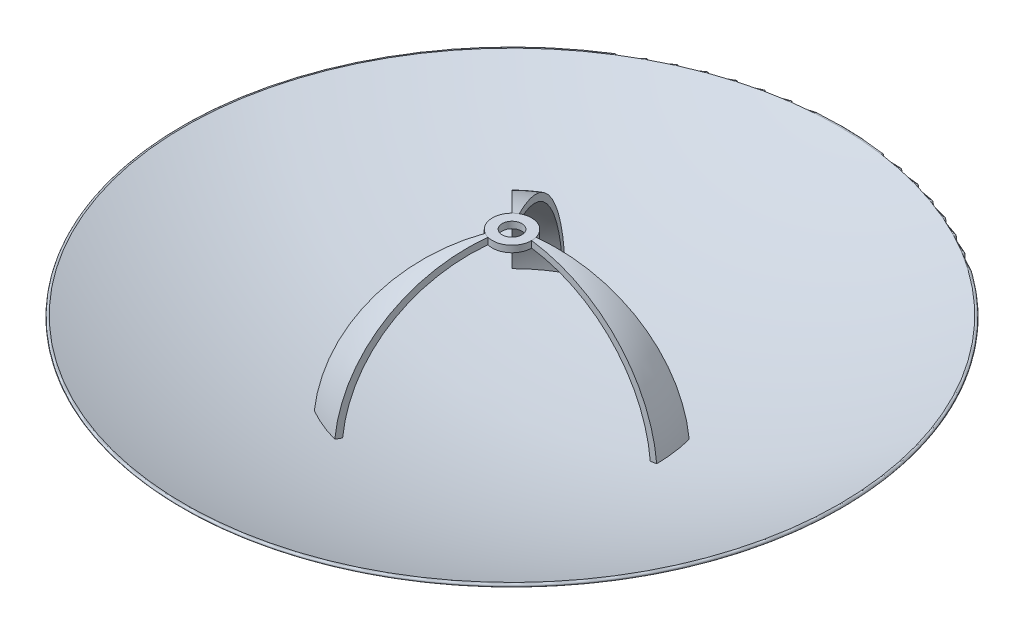
from build123d import *

# Parameters (mm, degrees)
BOSS_EXTRUDE1_DEPTH      = 0.0001
BOSS_EXTRUDE1_DEPTH_BACK = 50
SKETCH2_R                = 20
SKETCH2_R_2              = 15
CUT_EXTRUDE1_DEPTH       = 720.971206266
CUT_EXTRUDE1_DEPTH_BACK  = 720.971206266
SKETCH3_R                = 3
SKETCH8_R                = 30
BOSS_EXTRUDE6_DEPTH      = 10
REVOLVE6_ANGLE           = 15
CIRPATTERN2_COUNT        = 3
SKETCH10_R               = 15
CUT_EXTRUDE2_DEPTH       = 10


with BuildPart() as part:
    # Sketch1 → Revolve1 (revolve)
    with BuildSketch(Plane.XY):
        with BuildLine():
            Line((0, -5), (0, 0))
            ThreePointArc((0, 0), (255.566758163, 26.817376298), (500, 106.101232375))
            ThreePointArc((500, 106.101232375), (503.299845465, 104.831973771), (502.030587523, 101.532128052))
            ThreePointArc((502.030587523, 101.532128052), (256.604659504, 21.926286358), (0, -5))
        make_face()
    revolve(axis=Axis((0, 0, 0), (0, 1, 0)))

    # Sketch2 → Boss-Extrude1 (add, two sides: drawn at the far end of the back side and taken through both)
    with BuildSketch(Plane(origin=(0, 0, 0), x_dir=(1, 0, 0), z_dir=(0, 1, 0)).offset(-BOSS_EXTRUDE1_DEPTH_BACK)):
        Circle(SKETCH2_R)
        Circle(SKETCH2_R_2, mode=Mode.SUBTRACT)
    extrude(amount=BOSS_EXTRUDE1_DEPTH + BOSS_EXTRUDE1_DEPTH_BACK)

    # Sketch3 → Cut-Extrude1 (cut, two sides: drawn at the far end of the back side and taken through both)
    with BuildSketch(Plane(origin=(0, 0, 0), x_dir=(0, 0, -1), z_dir=(1, 0, 0)).offset(-CUT_EXTRUDE1_DEPTH_BACK)):
        with Locations((0, -35)):
            Circle(SKETCH3_R)
    extrude(amount=CUT_EXTRUDE1_DEPTH + CUT_EXTRUDE1_DEPTH_BACK, mode=Mode.SUBTRACT)


with BuildPart() as body_2:
    # Sketch8 → Boss-Extrude6 (new body)
    with BuildSketch(Plane(origin=(0, 210, 0), x_dir=(1, 0, 0), z_dir=(0, 1, 0))):
        Circle(SKETCH8_R)
    extrude(amount=BOSS_EXTRUDE6_DEPTH)

    # Sketch9 → Revolve6 (revolve)
    with BuildSketch(Plane.XY):
        with BuildLine():
            Line((30, 220), (30, 210))
            ThreePointArc((30, 210), (154.114389729, 145.769526577), (211.343355371, 18.275287705))
            Line((211.343355371, 18.275287705), (221.131489876, 20.021592974))
            ThreePointArc((221.131489876, 20.021592974), (160.513541862, 153.41252517), (30, 220))
        make_face()
    revolve6 = revolve(axis=Axis((0, 0, 0), (0, 1, 0)), revolution_arc=REVOLVE6_ANGLE)

    # CirPattern2: Revolve6 ×3 about axis
    cirpattern2_axis = Axis((0, 0, 0), (0, 1, 0))
    for i in range(1, CIRPATTERN2_COUNT):
        add(revolve6.rotate(cirpattern2_axis, i * 360 / CIRPATTERN2_COUNT))

    # Sketch10 → Cut-Extrude2 (cut)
    with BuildSketch(Plane(origin=(0, 220, 0), x_dir=(1, 0, 0), z_dir=(0, 1, 0))):
        Circle(SKETCH10_R)
    extrude(amount=-CUT_EXTRUDE2_DEPTH, mode=Mode.SUBTRACT)


solid = Compound([part.part, body_2.part])
